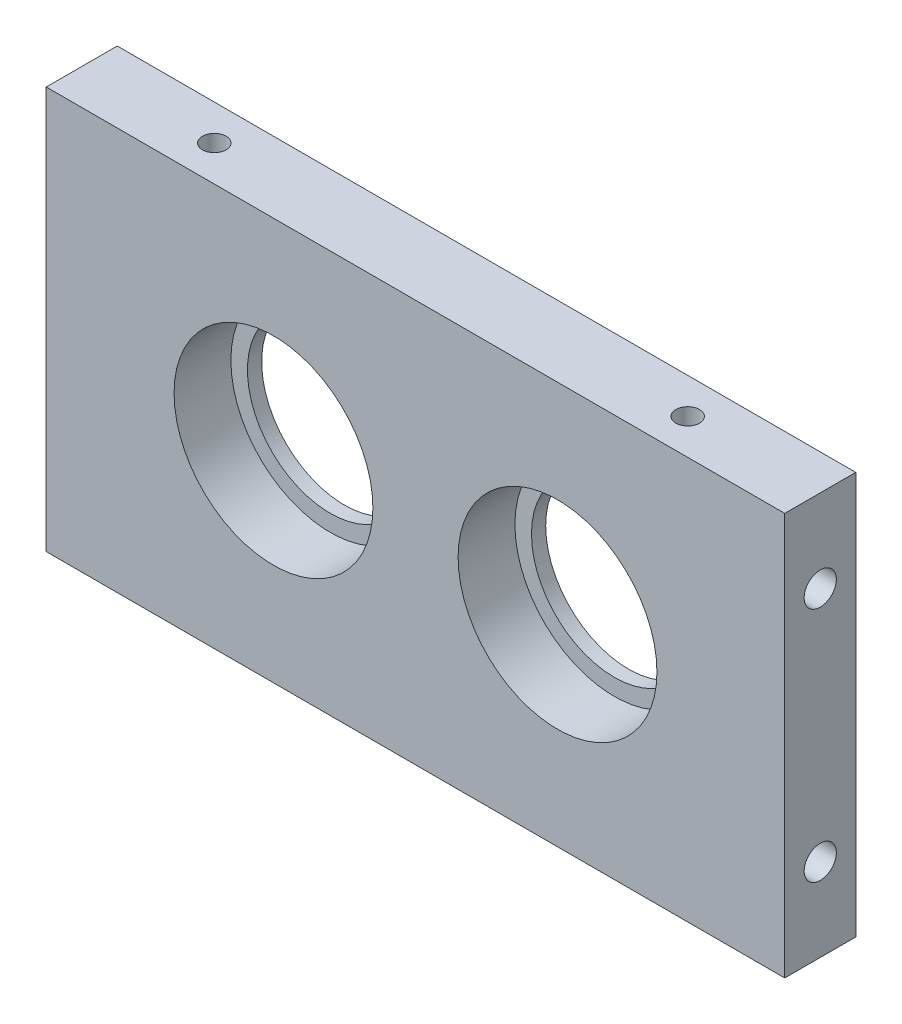
from build123d import *

# Parameters (mm, degrees)
SKETCH1_W                       = 156
SKETCH1_H                       = 85
SKETCH1_R                       = 17.5
BOSS_EXTRUDE1_DEPTH             = 7.5
SKETCH2_R                       = 21
CUT_EXTRUDE1_DEPTH              = 12
M8_TAPPED_HOLE1_D               = 6.8
M8_TAPPED_HOLE1_DEPTH           = 19.75
M8_TAPPED_HOLE1_TIP             = 2.042926105
M8_TAPPED_HOLE1_ON_FACE_2_D     = 6.8
M8_TAPPED_HOLE1_ON_FACE_2_DEPTH = 19.75
M8_TAPPED_HOLE1_ON_FACE_2_TIP   = 2.042926105
M6_TAPPED_HOLE1_D               = 5
M6_TAPPED_HOLE1_DEPTH           = 15
M6_TAPPED_HOLE1_TIP             = 1.502151548
M6_TAPPED_HOLE1_ON_FACE_2_D     = 5
M6_TAPPED_HOLE1_ON_FACE_2_DEPTH = 15
M6_TAPPED_HOLE1_ON_FACE_2_TIP   = 1.502151548


with BuildPart() as part:
    # Sketch1 → Boss-Extrude1 (new, symmetric)
    with BuildSketch(Plane.XY):
        Rectangle(SKETCH1_W, SKETCH1_H)
        with Locations((-30, 0)):
            Circle(SKETCH1_R, mode=Mode.SUBTRACT)
        with Locations(Location((30, 0, 0), (0, 0, 180))):
            Circle(SKETCH1_R, mode=Mode.SUBTRACT)
    extrude(amount=BOSS_EXTRUDE1_DEPTH, both=True)

    # Sketch2 → Cut-Extrude1 (cut)
    with BuildSketch(Plane.XY.offset(7.5)):
        with Locations((-30, 0)):
            Circle(SKETCH2_R)
        with Locations((30, 0)):
            Circle(SKETCH2_R)
    extrude(amount=-CUT_EXTRUDE1_DEPTH, mode=Mode.SUBTRACT)

    # M8 Tapped Hole1
    with Locations(Plane(origin=(-78, 25, 0), x_dir=(0, 0, -1), z_dir=(-1, 0, 0))):
        with Locations((0, 0), (0, 50)):
            Hole(M8_TAPPED_HOLE1_D / 2, depth=M8_TAPPED_HOLE1_DEPTH)
            with Locations((0, 0, -(M8_TAPPED_HOLE1_DEPTH + M8_TAPPED_HOLE1_TIP / 2))):  # 118° drill point
                Cone(0, M8_TAPPED_HOLE1_D / 2, M8_TAPPED_HOLE1_TIP, mode=Mode.SUBTRACT)

    # M8 Tapped Hole1 on face 2
    with Locations(Plane(origin=(78, 25, 0), x_dir=(0, 0, 1), z_dir=(1, 0, 0))):
        with Locations((0, 0), (0, 50)):
            Hole(M8_TAPPED_HOLE1_ON_FACE_2_D / 2, depth=M8_TAPPED_HOLE1_ON_FACE_2_DEPTH)
            with Locations((0, 0, -(M8_TAPPED_HOLE1_ON_FACE_2_DEPTH + M8_TAPPED_HOLE1_ON_FACE_2_TIP / 2))):  # 118° drill point
                Cone(0, M8_TAPPED_HOLE1_ON_FACE_2_D / 2, M8_TAPPED_HOLE1_ON_FACE_2_TIP, mode=Mode.SUBTRACT)

    # M6 Tapped Hole1
    with Locations(Plane(origin=(-50, -42.5, 0), x_dir=(0, 0, -1), z_dir=(0, -1, 0))):
        with Locations((0, 0), (0, 100)):
            Hole(M6_TAPPED_HOLE1_D / 2, depth=M6_TAPPED_HOLE1_DEPTH)
            with Locations((0, 0, -(M6_TAPPED_HOLE1_DEPTH + M6_TAPPED_HOLE1_TIP / 2))):  # 118° drill point
                Cone(0, M6_TAPPED_HOLE1_D / 2, M6_TAPPED_HOLE1_TIP, mode=Mode.SUBTRACT)

    # M6 Tapped Hole1 on face 2
    with Locations(Plane(origin=(-50, 42.5, 0), x_dir=(0, 0, 1), z_dir=(0, 1, 0))):
        with Locations((0, 0), (0, 100)):
            Hole(M6_TAPPED_HOLE1_ON_FACE_2_D / 2, depth=M6_TAPPED_HOLE1_ON_FACE_2_DEPTH)
            with Locations((0, 0, -(M6_TAPPED_HOLE1_ON_FACE_2_DEPTH + M6_TAPPED_HOLE1_ON_FACE_2_TIP / 2))):  # 118° drill point
                Cone(0, M6_TAPPED_HOLE1_ON_FACE_2_D / 2, M6_TAPPED_HOLE1_ON_FACE_2_TIP, mode=Mode.SUBTRACT)


solid = part.part
